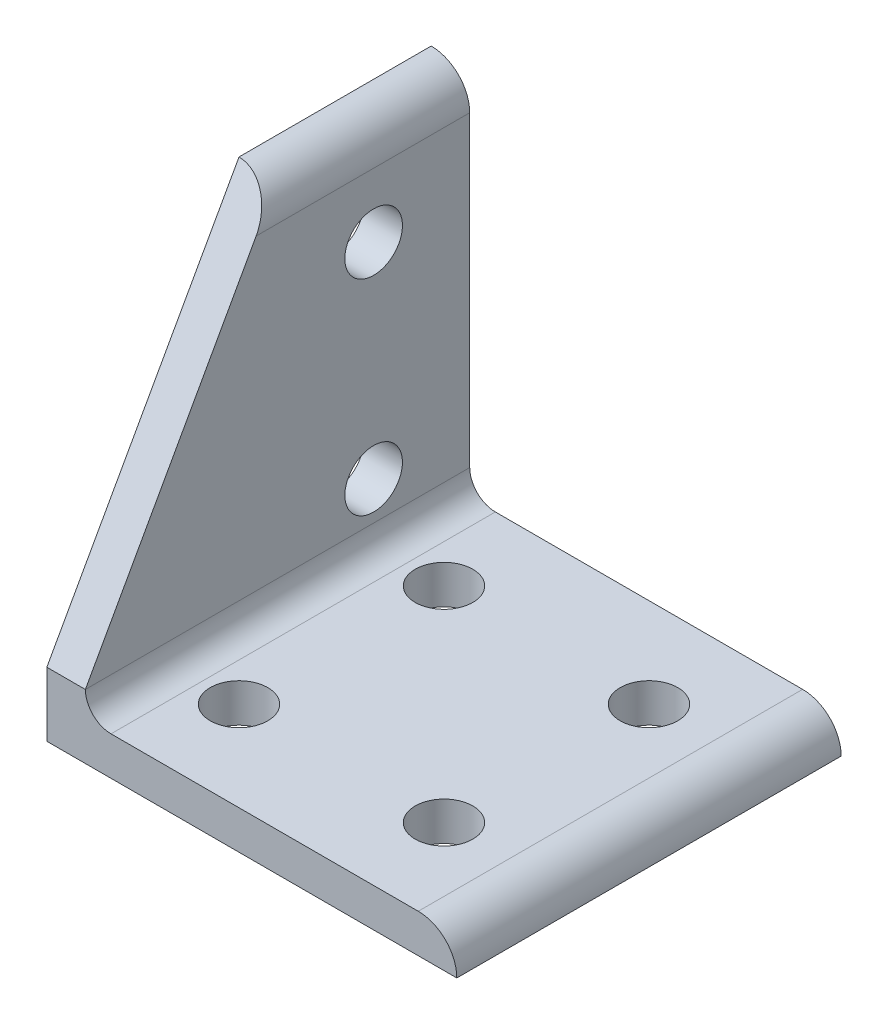
from build123d import *

# Parameters (mm, degrees)
BOSS_EXTRUDE1_DEPTH      = 23.8125
BOSS_EXTRUDE1_DEPTH_BACK = 23.8125
CUT_EXTRUDE1_DEPTH       = 58.710288262
CUT_EXTRUDE1_DEPTH_BACK  = 58.710288262
SKETCH6_R                = 3.5687
CUT_EXTRUDE2_DEPTH       = 58.710288262
SKETCH7_R                = 3.5687
CUT_EXTRUDE3_DEPTH       = 58.710288262


with BuildPart() as part:
    # Sketch4 → Boss-Extrude1 (new, two sides: drawn at the far end of the back side and taken through both)
    with BuildSketch(Plane.XY.offset(-BOSS_EXTRUDE1_DEPTH_BACK)):
        with BuildLine():
            Line((-25.4, 25.4), (-25.4, -25.4))
            Line((-25.4, -25.4), (25.4, -25.4))
            ThreePointArc((25.4, -25.4), (24.001376302, -22.023423698), (20.6248, -20.6248))
            Line((20.6248, -20.6248), (-17.4498, -20.6248))
            ThreePointArc((-17.4498, -20.6248), (-19.69486403, -19.69486403), (-20.6248, -17.4498))
            Line((-20.6248, -17.4498), (-20.6248, 20.6248))
            ThreePointArc((-20.6248, 20.6248), (-22.023423698, 24.001376302), (-25.4, 25.4))
        make_face()
    extrude(amount=BOSS_EXTRUDE1_DEPTH + BOSS_EXTRUDE1_DEPTH_BACK)

    # Sketch5 → Cut-Extrude1 (cut, two sides: drawn at the far end of the back side and taken through both)
    with BuildSketch(Plane(origin=(-20.6248, 0, 0), x_dir=(0, 0, -1), z_dir=(1, 0, 0)).offset(-CUT_EXTRUDE1_DEPTH_BACK)):
        Polygon((0, 25.4), (-23.8125, 25.4), (-23.8125, -17.4498), align=None)
    extrude(amount=CUT_EXTRUDE1_DEPTH + CUT_EXTRUDE1_DEPTH_BACK, mode=Mode.SUBTRACT)

    # Sketch6 → Cut-Extrude2 (cut, through all)
    with BuildSketch(Plane(origin=(-20.6248, 0, 0), x_dir=(0, 0, -1), z_dir=(1, 0, 0))):
        with Locations(Location((11.90625, 12.7, 0), (0, 0, 90))):
            Circle(SKETCH6_R)
        with Locations(Location((11.90625, -12.7, 0), (0, 0, 270))):
            Circle(SKETCH6_R)
    extrude(amount=-CUT_EXTRUDE2_DEPTH, mode=Mode.SUBTRACT)

    # Sketch7 → Cut-Extrude3 (cut, through all)
    with BuildSketch(Plane(origin=(0, -20.6248, 0), x_dir=(1, 0, 0), z_dir=(0, 1, 0))):
        with Locations(Location((-12.7, 12.7, 0), (0, 0, 180))):
            Circle(SKETCH7_R)
        with Locations(Location((12.7, 12.7, 0), (0, 0, 180))):
            Circle(SKETCH7_R)
        with Locations((12.7, -12.7)):
            Circle(SKETCH7_R)
        with Locations((-12.7, -12.7)):
            Circle(SKETCH7_R)
    extrude(amount=-CUT_EXTRUDE3_DEPTH, mode=Mode.SUBTRACT)


solid = part.part
